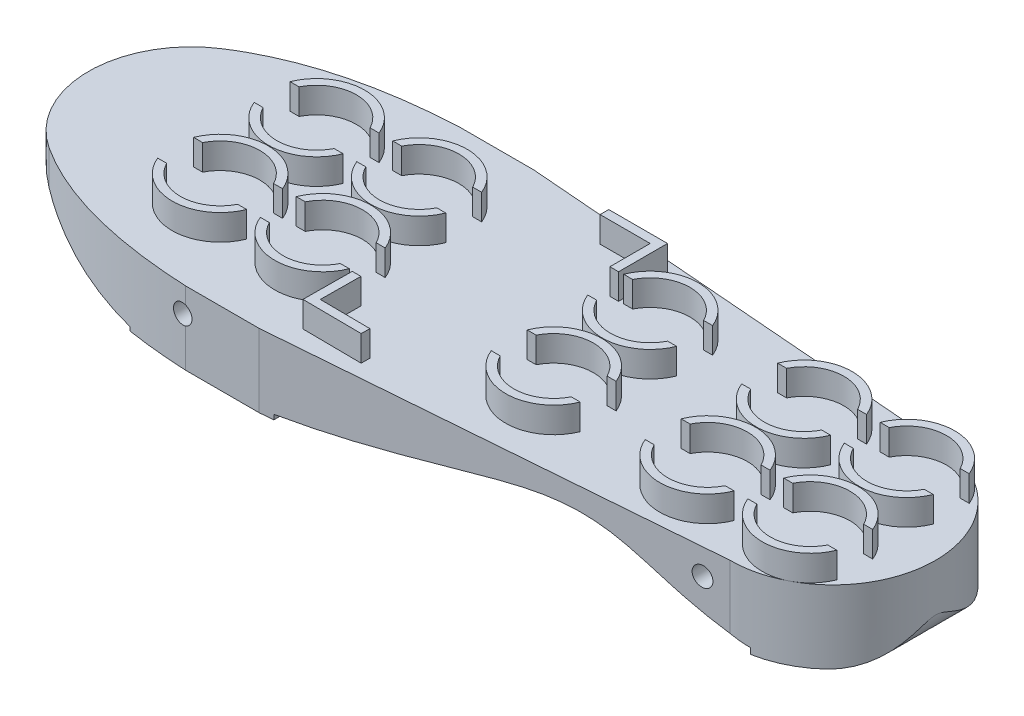
from build123d import *

# Parameters (mm, degrees)
BOSS_EXTRUDE1_DEPTH = 67.945
SKETCH2_OUTSIDE_W   = 257.315
SKETCH2_OUTSIDE_H   = 114.399
CUT_EXTRUDE4_DEPTH  = 203.496717616
SKETCH4_R           = 11.8745
SKETCH4_R_2         = 9.3345
BOSS_EXTRUDE4_DEPTH = 6.35
SKETCH6_W           = 205.263299325
SKETCH6_H           = 8.89
CUT_EXTRUDE2_DEPTH  = 202.325000853
SKETCH7_R           = 2.18026172
BOSS_EXTRUDE5_DEPTH = 109.728
BOSS_EXTRUDE7_DEPTH = 6.35
SKETCH10_R          = 9.8425
CUT_EXTRUDE5_DEPTH  = 6.35
SKETCH11_R          = 2.38125
CUT_EXTRUDE6_DEPTH  = 202.994260683


with BuildPart() as part:
    # Sketch1 → Boss-Extrude1 (new body)
    with BuildSketch(Plane.XY):
        with BuildLine():
            Line((-188.648837342, 18.078967276), (-189.898784902, 15.867806699))
            add(Edge.make_bspline(
                [(-145.926629619, 0.931500657), (-161.373254561, 2.93050099), (-175.913369633, 7.961987527), (-189.898784902, 15.867806699)],
                knots=[0.286304915, 0.286304915, 0.286304915, 0.286304915, 1, 1, 1, 1], degree=3))
            add(Edge.make_bspline(
                [(-134.052889876, 0), (-138.072310063, 0.115661904), (-142.028338321, 0.427009506), (-145.926629619, 0.931500657)],
                knots=[0.106188459, 0.106188459, 0.106188459, 0.106188459, 0.286304915, 0.286304915, 0.286304915, 0.286304915], degree=3))
            Line((-134.052889876, 0), (-126.876629619, 0))
            add(Edge.make_bspline(
                [(-126.876629619, 0), (-120.6789452, 0.175448796), (-114.749462123, 0.610628646), (-109.096629619, 1.219303764)],
                knots=[0, 0, 0, 0, 0.070483555, 0.070483555, 0.070483555, 0.070483555], degree=3))
            add(Edge.make_bspline(
                [(-109.096629619, 1.219303764), (-83.07835549, 4.020850789), (-30.445923704, 20.932731308), (-23.387080412, 5.575664861), (0.123370381, 1.471826455)],
                knots=[0.070483555, 0.070483555, 0.070483555, 0.070483555, 0.394897987, 0.917549691, 0.917549691, 0.917549691, 0.917549691], degree=3))
            add(Edge.make_bspline(
                [(0.123370381, 1.471826455), (3.83223408, 0.824430221), (8.017795436, 0.310715256), (12.823370381, 0)],
                knots=[0.917549691, 0.917549691, 0.917549691, 0.917549691, 1, 1, 1, 1], degree=3))
            add(Edge.make_bspline(
                [(12.823370381, 0), (19.974664706, 0.13158036), (20.962378502, 6.35)],
                knots=[0, 0, 0, 1, 1, 1], degree=2))
            Line((20.962378502, 6.35), (18.453825688, 6.748450469))
            add(Edge.make_bspline(
                [(18.453825688, 6.748450469), (18.423673531, 6.558619403), (18.347512601, 6.168200059), (18.161964909, 5.501745795), (17.866190972, 4.804631092), (17.435212346, 4.166906991), (16.915279411, 3.658066904), (16.252800453, 3.231335973), (15.387646051, 2.880846049), (14.460894189, 2.673485689), (13.603660839, 2.573996786), (13.115221979, 2.547917507), (12.878087895, 2.541808511)],
                knots=[0.008429853, 0.008429853, 0.008429853, 0.008429853, 0.070402988, 0.132376122, 0.25632239, 0.380268658, 0.504214927, 0.628161195, 0.752107463, 0.876053732, 0.938026866, 1, 1, 1, 1], degree=3))
            add(Edge.make_bspline(
                [(12.878087895, 2.541808511), (12.437437749, 2.570644014), (11.548619277, 2.633086839), (9.834559408, 2.770381395), (7.765736222, 2.967210232), (5.408787297, 3.239952223), (2.420723387, 3.648826878), (-1.037714153, 4.237420294), (-4.795868556, 5.045444945), (-8.212885225, 5.933683467), (-12.383307275, 7.197737469), (-17.004576547, 8.878513045), (-22.023633215, 10.908523585), (-26.925610138, 12.790296022), (-32.087340442, 14.319915835), (-37.830593885, 15.255363219), (-44.419624465, 15.396109393), (-52.216702766, 14.533668792), (-61.33620545, 12.701783265), (-71.78538202, 10.328664994), (-83.573180798, 7.750870227), (-94.49450243, 5.729573766), (-103.878871293, 4.364182968), (-111.235184323, 3.510211322), (-117.634533318, 2.976821746), (-122.897970174, 2.679580396), (-125.604111052, 2.577040987), (-126.948505089, 2.538982851)],
                knots=[0, 0, 0, 0, 0.007807529, 0.015615058, 0.031230117, 0.046845175, 0.062460234, 0.093690351, 0.124920467, 0.156150584, 0.187380701, 0.249840935, 0.312301169, 0.374761402, 0.437221636, 0.49968187, 0.562142104, 0.624602337, 0.687062571, 0.749522805, 0.811983038, 0.874443272, 0.905673389, 0.936903506, 0.968133623, 0.983748681, 0.99936374, 0.99936374, 0.99936374, 0.99936374], degree=3))
            add(Edge.make_bspline(
                [(-126.948505089, 2.538982851), (-128.333177205, 2.499784492), (-131.11587612, 2.467112762), (-136.585475743, 2.587895572), (-143.317021022, 3.08393859), (-151.218708694, 4.226227323), (-158.964686147, 5.910388385), (-166.568273996, 8.132438805), (-174.042953459, 10.888177379), (-180.179260912, 13.628839163), (-185.031196566, 16.081954721), (-187.452762337, 17.402837713), (-188.648837342, 18.078967276)],
                knots=[0, 0, 0, 0, 0.0625, 0.125, 0.25, 0.375, 0.5, 0.625, 0.75, 0.875, 0.9375, 1, 1, 1, 1], degree=3))
        make_face()
        with BuildLine():
            Line((20.962378502, 18.078967276), (-188.648837342, 18.078967276))
            add(Edge.make_bspline(
                [(-126.948505089, 2.538982851), (-128.333177205, 2.499784492), (-131.11587612, 2.467112762), (-136.585475743, 2.587895572), (-143.317021022, 3.08393859), (-151.218708694, 4.226227323), (-158.964686147, 5.910388385), (-166.568273996, 8.132438805), (-174.042953459, 10.888177379), (-180.179260912, 13.628839163), (-185.031196566, 16.081954721), (-187.452762337, 17.402837713), (-188.648837342, 18.078967276)],
                knots=[0, 0, 0, 0, 0.0625, 0.125, 0.25, 0.375, 0.5, 0.625, 0.75, 0.875, 0.9375, 1, 1, 1, 1], degree=3))
            add(Edge.make_bspline(
                [(12.878087895, 2.541808511), (12.437437749, 2.570644014), (11.548619277, 2.633086839), (9.834559408, 2.770381395), (7.765736222, 2.967210232), (5.408787297, 3.239952223), (2.420723387, 3.648826878), (-1.037714153, 4.237420294), (-4.795868556, 5.045444945), (-8.212885225, 5.933683467), (-12.383307275, 7.197737469), (-17.004576547, 8.878513045), (-22.023633215, 10.908523585), (-26.925610138, 12.790296022), (-32.087340442, 14.319915835), (-37.830593885, 15.255363219), (-44.419624465, 15.396109393), (-52.216702766, 14.533668792), (-61.33620545, 12.701783265), (-71.78538202, 10.328664994), (-83.573180798, 7.750870227), (-94.49450243, 5.729573766), (-103.878871293, 4.364182968), (-111.235184323, 3.510211322), (-117.634533318, 2.976821746), (-122.897970174, 2.679580396), (-125.604111052, 2.577040987), (-126.948505089, 2.538982851)],
                knots=[0, 0, 0, 0, 0.007807529, 0.015615058, 0.031230117, 0.046845175, 0.062460234, 0.093690351, 0.124920467, 0.156150584, 0.187380701, 0.249840935, 0.312301169, 0.374761402, 0.437221636, 0.49968187, 0.562142104, 0.624602337, 0.687062571, 0.749522805, 0.811983038, 0.874443272, 0.905673389, 0.936903506, 0.968133623, 0.983748681, 0.99936374, 0.99936374, 0.99936374, 0.99936374], degree=3))
            add(Edge.make_bspline(
                [(18.453825688, 6.748450469), (18.423673531, 6.558619403), (18.347512601, 6.168200059), (18.161964909, 5.501745795), (17.866190972, 4.804631092), (17.435212346, 4.166906991), (16.915279411, 3.658066904), (16.252800453, 3.231335973), (15.387646051, 2.880846049), (14.460894189, 2.673485689), (13.603660839, 2.573996786), (13.115221979, 2.547917507), (12.878087895, 2.541808511)],
                knots=[0.008429853, 0.008429853, 0.008429853, 0.008429853, 0.070402988, 0.132376122, 0.25632239, 0.380268658, 0.504214927, 0.628161195, 0.752107463, 0.876053732, 0.938026866, 1, 1, 1, 1], degree=3))
            Line((18.453825688, 6.748450469), (20.962378502, 6.35))
            Line((20.962378502, 6.35), (20.962378502, 18.078967276))
        make_face()
        with BuildLine():
            add(Edge.make_bspline(
                [(-134.052889876, 0), (-138.072310063, 0.115661904), (-142.028338321, 0.427009506), (-145.926629619, 0.931500657)],
                knots=[0.106188459, 0.106188459, 0.106188459, 0.106188459, 0.286304915, 0.286304915, 0.286304915, 0.286304915], degree=3))
            Line((-145.926629619, 0.931500657), (-145.926629619, 0))
            Line((-145.926629619, 0), (-134.052889876, 0))
        make_face()
        with BuildLine():
            add(Edge.make_bspline(
                [(-126.876629619, 0), (-120.6789452, 0.175448796), (-114.749462123, 0.610628646), (-109.096629619, 1.219303764)],
                knots=[0, 0, 0, 0, 0.070483555, 0.070483555, 0.070483555, 0.070483555], degree=3))
            Line((-126.876629619, 0), (-109.096629619, 0))
            Line((-109.096629619, 0), (-109.096629619, 1.219303764))
        make_face()
        with BuildLine():
            Line((0.123370381, 0), (12.823370381, 0))
            add(Edge.make_bspline(
                [(0.123370381, 1.471826455), (3.83223408, 0.824430221), (8.017795436, 0.310715256), (12.823370381, 0)],
                knots=[0.917549691, 0.917549691, 0.917549691, 0.917549691, 1, 1, 1, 1], degree=3))
            Line((0.123370381, 1.471826455), (0.123370381, 0))
        make_face()
    extrude(amount=-BOSS_EXTRUDE1_DEPTH)

    # Sketch2 outside → Cut-Extrude4 (cut, through all)
    with BuildSketch(Plane(origin=(0, 0, 0), x_dir=(1, 0, 0), z_dir=(0, 1, 0))):
        with Locations((-84.4685, 33.9725)):
            Rectangle(SKETCH2_OUTSIDE_W, SKETCH2_OUTSIDE_H)
        with BuildLine():
            Line((-4.437621498, 59.3725), (-112.448837342, 67.945))
            add(Edge.make_bspline(
                [(-177.141766797, 55.236236999), (-158.556694381, 67.379027328), (-133.348789381, 68.794669224), (-112.448837342, 67.945)],
                knots=[0, 0, 0, 0, 1, 1, 1, 1], degree=3))
            ThreePointArc((-177.141766797, 55.236236999), (-188.648837342, 33.9725), (-177.141766797, 12.708763001))
            add(Edge.make_bspline(
                [(-177.141766797, 12.708763001), (-158.556694381, 0.565972672), (-133.348789381, -0.849669224), (-112.448837342, 0)],
                knots=[0, 0, 0, 0, 1, 1, 1, 1], degree=3))
            Line((-112.448837342, 0), (-4.437621498, 8.5725))
            ThreePointArc((-4.437621498, 8.5725), (20.962378502, 33.9725), (-4.437621498, 59.3725))
        make_face(mode=Mode.SUBTRACT)
    extrude(amount=CUT_EXTRUDE4_DEPTH, mode=Mode.SUBTRACT)

    # Sketch4 → Boss-Extrude4 (add)
    # profile 1 of 10: a face of its own
    with BuildSketch(Plane(origin=(0, 18.078967276, 0), x_dir=(1, 0, 0), z_dir=(0, 1, 0))):
        with Locations(Location((1.912378502, 45.9105, 0), (0, 0, 90))):
            Circle(SKETCH4_R)
        with Locations(Location((1.912378502, 45.9105, 0), (0, 0, 270))):
            Circle(SKETCH4_R_2, mode=Mode.SUBTRACT)
    # profile 2 of 10: a face of its own
    with BuildSketch(Plane(origin=(0, 18.078967276, 0), x_dir=(1, 0, 0), z_dir=(0, 1, 0))):
        with Locations(Location((-23.487621498, 45.9105, 0), (0, 0, 90))):
            Circle(SKETCH4_R)
        with Locations(Location((-23.487621498, 45.9105, 0), (0, 0, 90))):
            Circle(SKETCH4_R_2, mode=Mode.SUBTRACT)
    # profile 3 of 10: a face of its own
    with BuildSketch(Plane(origin=(0, 18.078967276, 0), x_dir=(1, 0, 0), z_dir=(0, 1, 0))):
        with Locations(Location((-61.587621498, 45.9105, 0), (0, 0, 90))):
            Circle(SKETCH4_R)
        with Locations(Location((-61.587621498, 45.9105, 0), (0, 0, 270))):
            Circle(SKETCH4_R_2, mode=Mode.SUBTRACT)
    # profile 4 of 10: a face of its own
    with BuildSketch(Plane(origin=(0, 18.078967276, 0), x_dir=(1, 0, 0), z_dir=(0, 1, 0))):
        with Locations(Location((-118.737621498, 45.9105, 0), (0, 0, 90))):
            Circle(SKETCH4_R)
        with Locations(Location((-118.737621498, 45.9105, 0), (0, 0, 270))):
            Circle(SKETCH4_R_2, mode=Mode.SUBTRACT)
    # profile 5 of 10: a face of its own
    with BuildSketch(Plane(origin=(0, 18.078967276, 0), x_dir=(1, 0, 0), z_dir=(0, 1, 0))):
        with Locations(Location((-144.137621498, 45.9105, 0), (0, 0, 90))):
            Circle(SKETCH4_R)
        with Locations(Location((-144.137621498, 45.9105, 0), (0, 0, 90))):
            Circle(SKETCH4_R_2, mode=Mode.SUBTRACT)
    # profile 6 of 10: a face of its own
    with BuildSketch(Plane(origin=(0, 18.078967276, 0), x_dir=(1, 0, 0), z_dir=(0, 1, 0))):
        with Locations(Location((1.912378502, 22.0345, 0), (0, 0, 90))):
            Circle(SKETCH4_R)
        with Locations(Location((1.912378502, 22.0345, 0), (0, 0, 90))):
            Circle(SKETCH4_R_2, mode=Mode.SUBTRACT)
    # profile 7 of 10: a face of its own
    with BuildSketch(Plane(origin=(0, 18.078967276, 0), x_dir=(1, 0, 0), z_dir=(0, 1, 0))):
        with Locations(Location((-23.487621498, 22.0345, 0), (0, 0, 90))):
            Circle(SKETCH4_R)
        with Locations(Location((-23.487621498, 22.0345, 0), (0, 0, 270))):
            Circle(SKETCH4_R_2, mode=Mode.SUBTRACT)
    # profile 8 of 10: a face of its own
    with BuildSketch(Plane(origin=(0, 18.078967276, 0), x_dir=(1, 0, 0), z_dir=(0, 1, 0))):
        with Locations(Location((-61.587621498, 22.0345, 0), (0, 0, 90))):
            Circle(SKETCH4_R)
        with Locations(Location((-61.587621498, 22.0345, 0), (0, 0, 90))):
            Circle(SKETCH4_R_2, mode=Mode.SUBTRACT)
    # profile 9 of 10: a face of its own
    with BuildSketch(Plane(origin=(0, 18.078967276, 0), x_dir=(1, 0, 0), z_dir=(0, 1, 0))):
        with Locations(Location((-118.737621498, 22.0345, 0), (0, 0, 90))):
            Circle(SKETCH4_R)
        with Locations(Location((-118.737621498, 22.0345, 0), (0, 0, 90))):
            Circle(SKETCH4_R_2, mode=Mode.SUBTRACT)
    # profile 10 of 10: a face of its own
    with BuildSketch(Plane(origin=(0, 18.078967276, 0), x_dir=(1, 0, 0), z_dir=(0, 1, 0))):
        with Locations(Location((-144.137621498, 22.0345, 0), (0, 0, 90))):
            Circle(SKETCH4_R)
        with Locations(Location((-144.137621498, 22.0345, 0), (0, 0, 270))):
            Circle(SKETCH4_R_2, mode=Mode.SUBTRACT)
    extrude(amount=BOSS_EXTRUDE4_DEPTH)

    # Sketch6 → Cut-Extrude2 (cut, through all)
    with BuildSketch(Plane(origin=(0, 18.078967276, 0), x_dir=(1, 0, 0), z_dir=(0, 1, 0))):
        with Locations((-61.587621498, 45.9105)):
            Rectangle(SKETCH6_W, SKETCH6_H)
        with Locations((-61.587621498, 22.0345)):
            Rectangle(SKETCH6_W, SKETCH6_H)
    extrude(amount=CUT_EXTRUDE2_DEPTH, mode=Mode.SUBTRACT)

    # Sketch7 → Boss-Extrude5 (add)
    with BuildSketch(Plane(origin=(0, 0, 0), x_dir=(0, 0, -1), z_dir=(1, 0, 0))):
        with Locations((33.9725, 6.86216336)):
            Circle(SKETCH7_R)
    extrude(amount=-BOSS_EXTRUDE5_DEPTH)

    # Sketch9 → Boss-Extrude7 (add)
    with BuildSketch(Plane(origin=(0, 18.078967276, 0), x_dir=(1, 0, 0), z_dir=(0, 1, 0))):
        Polygon((-73.760161107, 62.379033498), (-73.760161107, 50.260764863), (-75.905881411, 50.260764863), (-75.905881411, 60.233313194), (-88.300817663, 60.233313194), (-88.300817663, 62.379033498), align=None)
        Polygon((-92.338259086, 7.303929378), (-92.3571527, 5.158292257), (-106.897245559, 5.286326441), (-106.790541118, 17.404125287), (-104.644903997, 17.385231673), (-104.732714824, 7.413069948), align=None)
    extrude(amount=BOSS_EXTRUDE7_DEPTH)

    # Sketch10 → Cut-Extrude5 (cut)
    with BuildSketch(Plane(origin=(0, 24.428967276, 0), x_dir=(1, 0, 0), z_dir=(0, 1, 0))):
        with Locations((-144.137621498, 45.9105)):
            Circle(SKETCH10_R)
        with Locations((-118.737621498, 45.9105)):
            Circle(SKETCH10_R)
        with Locations((-144.137621498, 22.0345)):
            Circle(SKETCH10_R)
        with Locations((-118.737621498, 22.0345)):
            Circle(SKETCH10_R)
        with Locations((-23.487621498, 45.9105)):
            Circle(SKETCH10_R)
        with Locations((-23.487621498, 22.0345)):
            Circle(SKETCH10_R)
        with Locations((1.912378502, 45.9105)):
            Circle(SKETCH10_R)
        with Locations((1.912378502, 22.0345)):
            Circle(SKETCH10_R)
        with Locations((-61.587621498, 22.0345)):
            Circle(SKETCH10_R)
        with Locations((-61.587621498, 45.9105)):
            Circle(SKETCH10_R)
    extrude(amount=-CUT_EXTRUDE5_DEPTH, mode=Mode.SUBTRACT)

    # Sketch11 → Cut-Extrude6 (cut, through all)
    with BuildSketch(Plane.XY):
        with Locations(Location((-131.437621498, 11.728967276, 0), (0, 0, 288.623921954))):
            Circle(SKETCH11_R)
        with Locations((-10.787621498, 11.728967276)):
            Circle(SKETCH11_R)
    extrude(amount=-CUT_EXTRUDE6_DEPTH, mode=Mode.SUBTRACT)


solid = part.part
